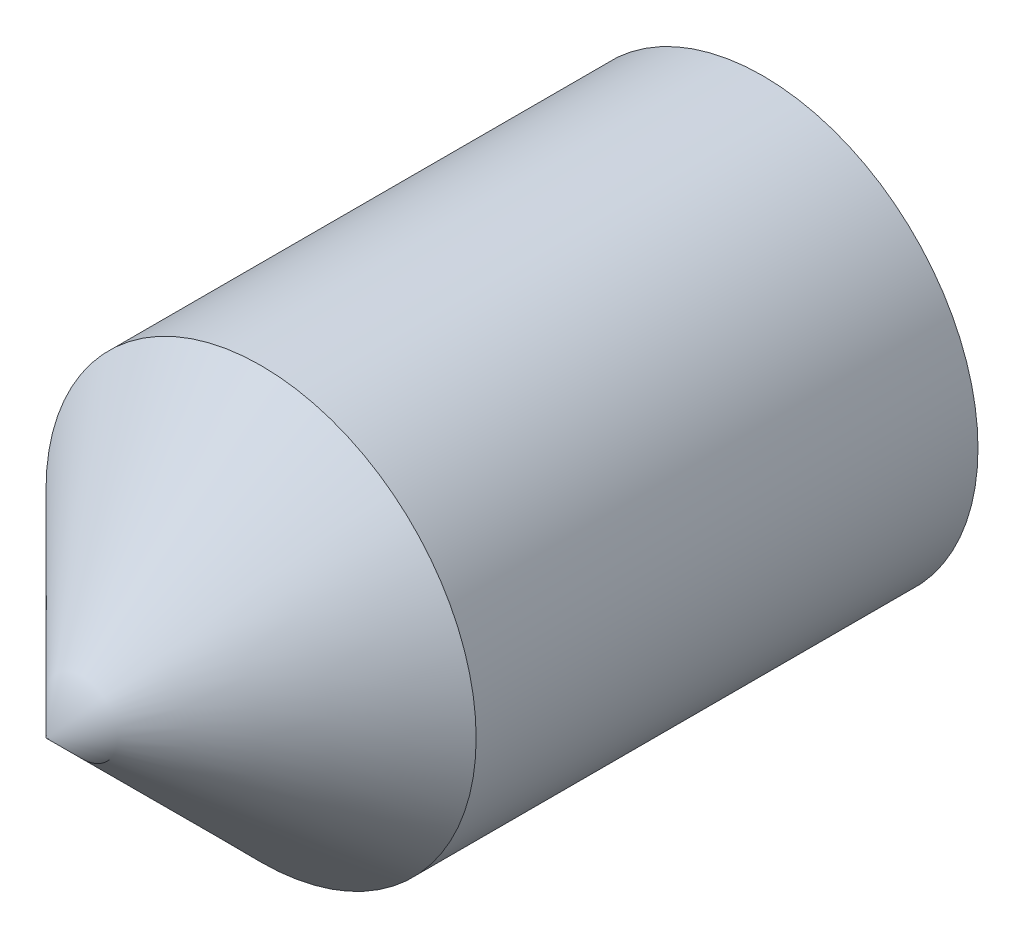
from build123d import *

# Parameters (mm, degrees)
SKETCH1_R           = 7.5
BOSS_EXTRUDE1_DEPTH = 25
CHAMFER1_SIZE       = 7.5


with BuildPart() as part:
    # Sketch1 → Boss-Extrude1 (new body)
    with BuildSketch(Plane.XY):
        Circle(SKETCH1_R)
    extrude(amount=BOSS_EXTRUDE1_DEPTH)

    # Chamfer1
    chamfer1_edges = [part.edges().sort_by_distance(p)[0] for p in [
        (-7.5, 0, 25),
    ]]
    chamfer(chamfer1_edges, length=CHAMFER1_SIZE)


solid = part.part
